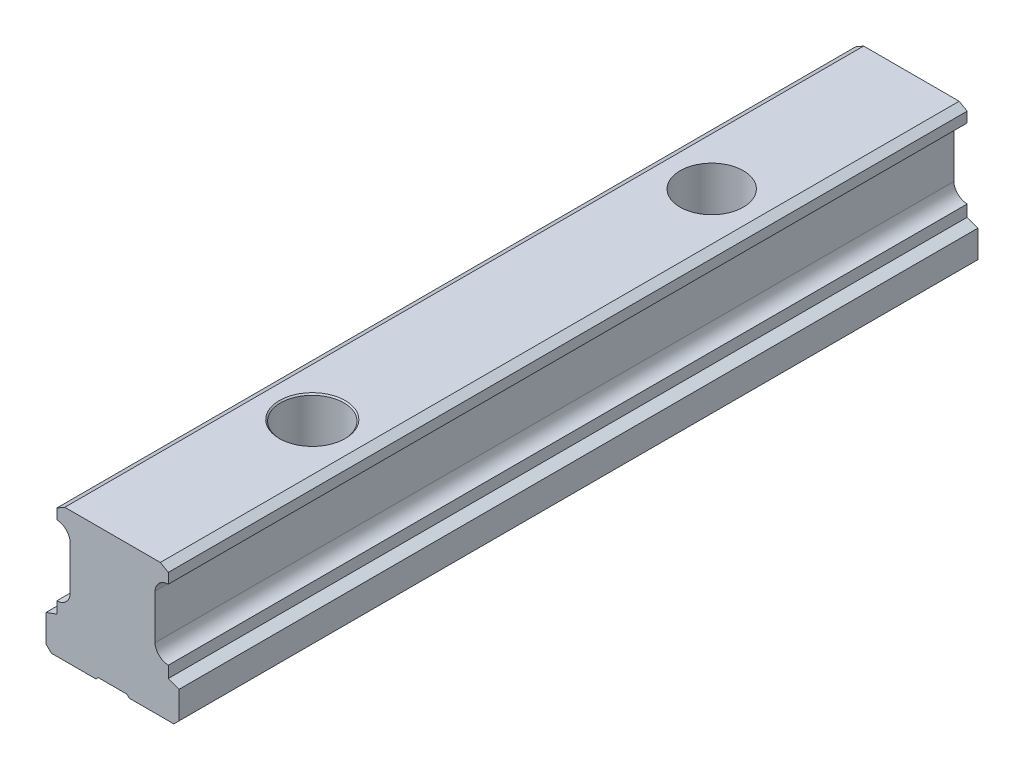
from build123d import *

# Parameters (mm, degrees)
BOSS_EXTRU_1_DEPTH      = 1980
ENL_V_MAT_EXTRU_1_DEPTH = 1981.194091497
ESQUISSE3_W             = 4.3
ESQUISSE3_H             = 0.35
ENL_V_MAT_EXTRU_2_DEPTH = 1980
ESQUISSE4_W             = 1.625
ESQUISSE4_H             = 14.5
ENL_V_MAT_EXTRU_3_DEPTH = 1981.194091497
ENL_V_MAT_EXTRU_4_DEPTH = 1981.194091497
D_POUILLE1_ANGLE        = 20
D_POUILLE2_ANGLE        = 20
D_POUILLE3_ANGLE        = 45
PER_AGE1_D              = 6
PER_AGE1_DEPTH          = 20
PER_AGE1_CBORE_D        = 9.5
PER_AGE1_CBORE_DEPTH    = 8.5
CHANFREIN1_SIZE         = 0.8
CHANFREIN2_SIZE         = 1.2
CHANFREIN2_SIZE2        = 0.692820323
CHANFREIN3_SIZE         = 0.2
CHANFREIN4_SIZE         = 0.692820323
CHANFREIN4_SIZE2        = 1.2
ENL_V_START             = -120
ESQUISSE12_W            = 78.153878041
ESQUISSE12_H            = 74.514600195
ENL_V_MAT_EXTRU_5_DEPTH = 1861.194091497


with BuildPart() as part:
    # Esquisse1 → Boss.-Extru.1 (new body)
    with BuildSketch(Plane(origin=(0, 0, 0), x_dir=(-1, 0, 0), z_dir=(0, 0, -1))):
        with BuildLine():
            Line((-19.2, 7.973691854), (-19.2, 0))
            Line((-19.2, 0), (0.8, 0))
            Line((0.8, 0), (0.8, 20))
            Line((0.8, 20), (-17.575, 20))
            Line((-17.575, 20), (-17.575, 17.767136655))
            ThreePointArc((-17.575, 17.767136655), (-16.197491801, 17.200016465), (-15.5625262, 15.852436102))
            Line((-15.5625262, 15.852436102), (-15.5625262, 9.147563898))
            ThreePointArc((-15.5625262, 9.147563898), (-16.984759825, 7.331984363), (-19.2, 7.973691854))
        make_face()
    extrude(amount=-BOSS_EXTRU_1_DEPTH)

    # Esquisse2 → Enlèv. mat.-Extru.1 (cut, through all)
    with BuildSketch(Plane.XY.offset(1980)):
        with BuildLine():
            Line((17.575, 7.232863345), (17.575, 4.908548369))
            Line((17.575, 4.908548369), (19.2, 4.908548369))
            Line((19.2, 4.908548369), (19.2, 7.973691854))
            ThreePointArc((19.2, 7.973691854), (18.471955551, 7.418025184), (17.575, 7.232863345))
        make_face()
    extrude(amount=-ENL_V_MAT_EXTRU_1_DEPTH, mode=Mode.SUBTRACT)

    # Esquisse3 → Enlèv. mat.-Extru.2 (cut)
    with BuildSketch(Plane.XY.offset(1980)):
        with Locations((9.2, 0.175)):
            Rectangle(ESQUISSE3_W, ESQUISSE3_H)
    extrude(amount=-ENL_V_MAT_EXTRU_2_DEPTH, mode=Mode.SUBTRACT)

    # Esquisse4 → Enlèv. mat.-Extru.3 (cut, through all)
    with BuildSketch(Plane.XY.offset(1980)):
        with Locations((0.0125, 12.75)):
            Rectangle(ESQUISSE4_W, ESQUISSE4_H)
    extrude(amount=-ENL_V_MAT_EXTRU_3_DEPTH, mode=Mode.SUBTRACT)

    # Esquisse5 → Enlèv. mat.-Extru.4 (cut, through all)
    with BuildSketch(Plane.XY.offset(1980)):
        with BuildLine():
            Line((0.825, 17.767136655), (0.825, 7.232863345))
            ThreePointArc((0.825, 7.232863345), (2.202508199, 7.799983535), (2.8374738, 9.147563898))
            Line((2.8374738, 9.147563898), (2.8374738, 15.852436102))
            ThreePointArc((2.8374738, 15.852436102), (2.202508199, 17.200016465), (0.825, 17.767136655))
        make_face()
    extrude(amount=-ENL_V_MAT_EXTRU_4_DEPTH, mode=Mode.SUBTRACT)

    # Dépouille1
    d_pouille1_faces = [part.faces().sort_by_distance(p)[0] for p in [
        (0.0125, 5.5, 990),
    ]]
    draft(d_pouille1_faces, Plane(origin=(0.825, 5.5, 0), x_dir=(0, -1, 0), z_dir=(-1, 0, 0)), D_POUILLE1_ANGLE)

    # Dépouille2
    d_pouille2_faces = [part.faces().sort_by_distance(p)[0] for p in [
        (18.3875, 4.908548369, 990),
    ]]
    draft(d_pouille2_faces, Plane(origin=(19.2, 7.973691854, 1980), x_dir=(0, 0, 1), z_dir=(1, 0, 0)), D_POUILLE2_ANGLE)

    # Dépouille3
    d_pouille3_faces = [part.faces().sort_by_distance(p)[0] for p in [
        (11.35, 0.175, 990),
        (7.05, 0.175, 990),
    ]]
    draft(d_pouille3_faces, Plane(origin=(11.35, 0.35, 0), x_dir=(0, 0, -1), z_dir=(0, -1, 0)), D_POUILLE3_ANGLE)

    # Perçage1
    with Locations(Plane(origin=(0, 20, 0), x_dir=(1, 0, 0), z_dir=(0, 1, 0))):
        with Locations((9.2, -30), (9.2, -90), (9.2, -150), (9.2, -210), (9.2, -270), (9.2, -330), (9.2, -390), (9.2, -450), (9.2, -510), (9.2, -570), (9.2, -630), (9.2, -690), (9.2, -750), (9.2, -810), (9.2, -870), (9.2, -930), (9.2, -990), (9.2, -1050), (9.2, -1110), (9.2, -1170), (9.2, -1230), (9.2, -1290), (9.2, -1350), (9.2, -1410), (9.2, -1470), (9.2, -1530), (9.2, -1590), (9.2, -1650), (9.2, -1710), (9.2, -1770), (9.2, -1830), (9.2, -1890), (9.2, -1950)):
            CounterBoreHole(PER_AGE1_D / 2, PER_AGE1_CBORE_D / 2, PER_AGE1_CBORE_DEPTH, depth=PER_AGE1_DEPTH)

    # Chanfrein1
    chanfrein1_edges = [part.edges().sort_by_distance(p)[0] for p in [
        (-0.8, 0, 990),
        (19.2, 0, 990),
    ]]
    chamfer(chanfrein1_edges, length=CHANFREIN1_SIZE)

    # Chanfrein2
    chanfrein2_edges = [part.edges().sort_by_distance(p)[0] for p in [
        (0.825, 20, 990),
    ]]
    chanfrein2_side = [part.faces().sort_by_distance(p)[0] for p in [
        (9.2, 20, 19.800708478),
    ]]
    chamfer(chanfrein2_edges, length=CHANFREIN2_SIZE, length2=CHANFREIN2_SIZE2, reference=chanfrein2_side[0])

    # Chanfrein3
    chanfrein3_edges = [part.edges().sort_by_distance(p)[0] for p in [
        (12.2, 0, 1950),
        (6.327718677, 0, 1949.133974596),
        (4.45, 20, 1950),
    ]]
    chamfer(chanfrein3_edges, length=CHANFREIN3_SIZE)

    # Chanfrein4
    chanfrein4_edges = [part.edges().sort_by_distance(p)[0] for p in [
        (17.575, 20, 990),
    ]]
    chanfrein4_side = [part.faces().sort_by_distance(p)[0] for p in [
        (17.575, 18.883568328, 990),
    ]]
    chamfer(chanfrein4_edges, length=CHANFREIN4_SIZE, length2=CHANFREIN4_SIZE2, reference=chanfrein4_side[0])

    # Esquisse12 → Enlèv. mat.-Extru.5 (cut, through all)
    with BuildSketch(Plane.XY.offset(1980).offset(ENL_V_START)):
        with Locations((15.863080013, 8.671326529)):
            Rectangle(ESQUISSE12_W, ESQUISSE12_H)
    extrude(amount=-ENL_V_MAT_EXTRU_5_DEPTH, mode=Mode.SUBTRACT)


solid = part.part
